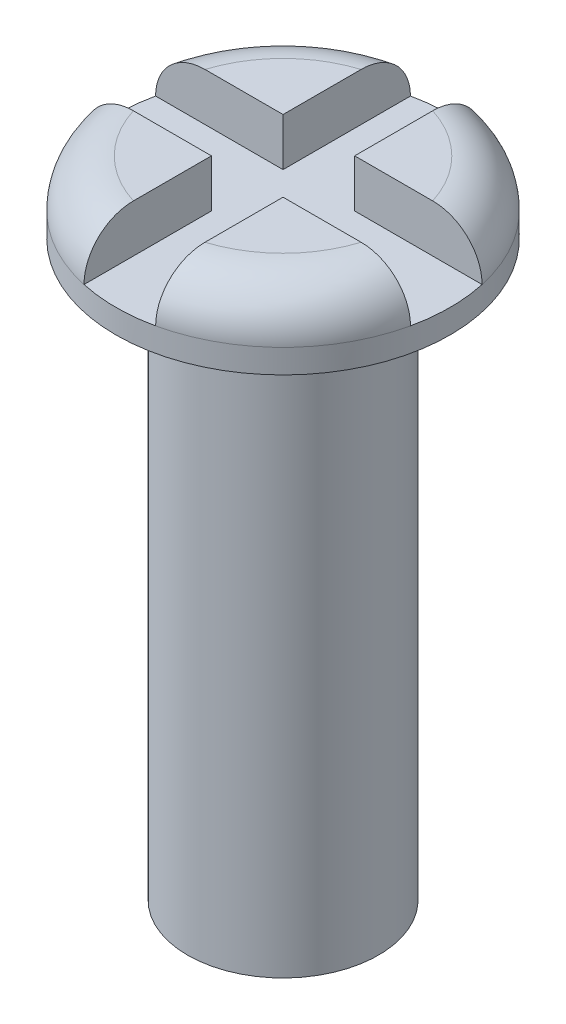
from build123d import *

# Parameters (mm, degrees)
SKETCH_1_R          = 1
EXTRUDE_1_DEPTH     = 6
SKETCH_2_R          = 1.75
EXTRUDE_2_DEPTH     = 0.75
FILLET_1_R          = 0.5
SKETCH_3_W          = 7.004697232
SKETCH_3_H          = 0.75
CUT_EXTRUDE_1_DEPTH = 0.5
SKETCH_4_W          = 0.75
SKETCH_4_H          = 3.75
CUT_EXTRUDE_2_DEPTH = 0.5


with BuildPart() as part:
    # 草图1 → 拉伸1 (new body)
    with BuildSketch(Plane(origin=(0, 0, 0), x_dir=(1, 0, 0), z_dir=(0, 1, 0))):
        with Locations(Location((0, 0, 0), (0, 0, 270))):
            Circle(SKETCH_1_R)
    extrude(amount=EXTRUDE_1_DEPTH)

    # 草图2 → 拉伸2 (add)
    with BuildSketch(Plane(origin=(0, 6, 0), x_dir=(-1, 0, 0), z_dir=(0, 1, 0))):
        with Locations(Location((0, 0, 0), (0, 0, 90))):
            Circle(SKETCH_2_R)
    extrude(amount=EXTRUDE_2_DEPTH)

    # 圆角1
    fillet_1_edges = [part.edges().sort_by_distance(p)[0] for p in [
        (0, 6.75, -1.75),
    ]]
    fillet(fillet_1_edges, radius=FILLET_1_R)

    # 草图3 → 切除-拉伸1 (cut)
    with BuildSketch(Plane(origin=(0, 6.75, 0), x_dir=(-1, 0, 0), z_dir=(0, 1, 0))):
        Rectangle(SKETCH_3_W, SKETCH_3_H)
    extrude(amount=-CUT_EXTRUDE_1_DEPTH, mode=Mode.SUBTRACT)

    # 草图4 → 切除-拉伸2 (cut)
    with BuildSketch(Plane(origin=(0, 6.75, 0), x_dir=(-1, 0, 0), z_dir=(0, 1, 0))):
        Rectangle(SKETCH_4_W, SKETCH_4_H)
    extrude(amount=-CUT_EXTRUDE_2_DEPTH, mode=Mode.SUBTRACT)


solid = part.part
